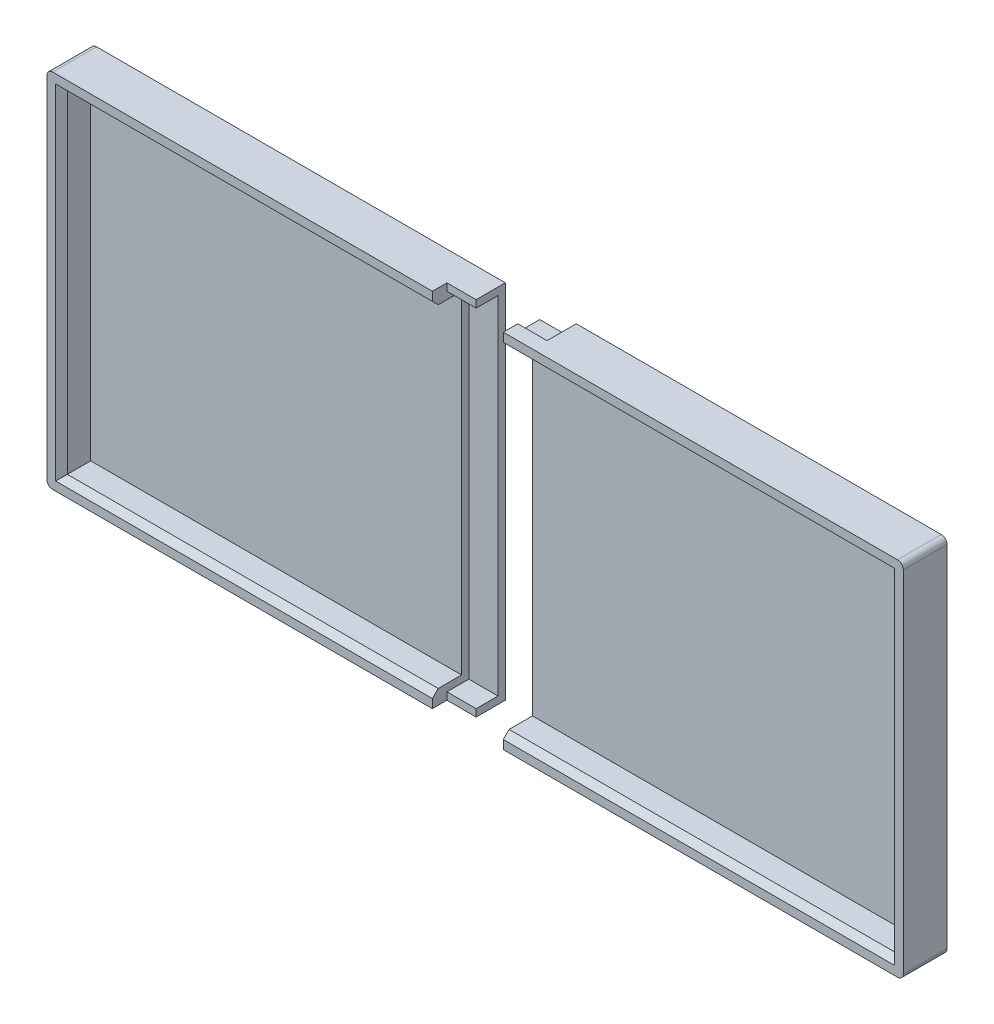
from build123d import *

# Parameters (mm, degrees)
BOSS_EXTRUDE1_DEPTH = 12.7
SKETCH2_W           = 167.64
SKETCH2_H           = 157.226
BOSS_EXTRUDE2_DEPTH = 6.35
FILLET1_R           = 2.54
FILLET2_SIZE        = 2.54
BOSS_EXTRUDE6_DEPTH = 12.7
SKETCH8_W           = 173.99
SKETCH8_H           = 157.226
BOSS_EXTRUDE7_DEPTH = 6.35
CHAMFER1_SIZE       = 2.54
FILLET4_R           = 2.54
BOSS_EXTRUDE8_DEPTH = 12.7
CUT_EXTRUDE1_DEPTH  = 12.7


with BuildPart() as part:
    # Sketch1 → Boss-Extrude1 (new body)
    with BuildSketch(Plane.XY):
        Polygon((-80.645, 72.263), (80.645, 72.263), (80.645, 78.613), (-86.995, 78.613), (-86.995, -78.613), (80.645, -78.613), (80.645, -72.263), (-80.645, -72.263), align=None)
    extrude(amount=BOSS_EXTRUDE1_DEPTH)

    # Sketch2 → Boss-Extrude2 (add)
    with BuildSketch(Plane(origin=(0, 0, 0), x_dir=(-1, 0, 0), z_dir=(0, 0, -1))):
        with Locations((3.175, 0)):
            Rectangle(SKETCH2_W, SKETCH2_H)
    extrude(amount=BOSS_EXTRUDE2_DEPTH)

    # Fillet1
    fillet1_edges = [part.edges().sort_by_distance(p)[0] for p in [
        (-86.995, -78.613, 3.175),
        (-86.995, 78.613, 3.175),
    ]]
    fillet(fillet1_edges, radius=FILLET1_R)

    # Fillet2
    fillet2_edges = [part.edges().sort_by_distance(p)[0] for p in [
        (0, -72.263, 12.7),
        (-80.645, 0, 12.7),
        (0, 72.263, 12.7),
    ]]
    chamfer(fillet2_edges, length=FILLET2_SIZE)

    # Sketch9 → Boss-Extrude8 (add)
    with BuildSketch(Plane(origin=(80.645, 0, 0), x_dir=(0, 0, -1), z_dir=(1, 0, 0))):
        Polygon((6.35, -78.613), (-6.355883999, -78.613), (-6.355883999, -75.438), (3.175, -75.438), (3.175, 75.438), (-6.355883999, 75.438), (-6.355883999, 78.613), (6.35, 78.613), align=None)
    extrude(amount=BOSS_EXTRUDE8_DEPTH)


with BuildPart() as body_2:
    # Sketch7 → Boss-Extrude6 (new body)
    with BuildSketch(Plane.XY):
        Polygon((285.472121408, 78.613), (111.482121408, 78.613), (111.482121408, 72.263), (279.122121408, 72.263), (279.122121408, -72.263), (111.482121408, -72.263), (111.482121408, -78.613), (285.472121408, -78.613), align=None)
    extrude(amount=BOSS_EXTRUDE6_DEPTH)

    # Sketch8 → Boss-Extrude7 (add)
    with BuildSketch(Plane(origin=(0, 0, 0), x_dir=(-1, 0, 0), z_dir=(0, 0, -1))):
        with Locations((-198.477121408, 0)):
            Rectangle(SKETCH8_W, SKETCH8_H)
    extrude(amount=BOSS_EXTRUDE7_DEPTH)

    # Chamfer1
    chamfer1_edges = [body_2.edges().sort_by_distance(p)[0] for p in [
        (279.122121408, 0, 12.7),
        (195.302121408, -72.263, 12.7),
        (195.302121408, 72.263, 12.7),
    ]]
    chamfer(chamfer1_edges, length=CHAMFER1_SIZE)

    # Fillet4
    fillet4_edges = [body_2.edges().sort_by_distance(p)[0] for p in [
        (285.472121408, 78.613, 3.175),
        (285.472121408, -78.613, 3.175),
    ]]
    fillet(fillet4_edges, radius=FILLET4_R)

    # Sketch10 → Cut-Extrude1 (cut)
    with BuildSketch(Plane.ZY.offset(-111.482121408)):
        Polygon((-6.35, 78.613), (6.355883999, 78.613), (6.355883999, 75.438), (-3.175, 75.438), (-3.175, -75.438), (6.355883999, -75.438), (6.355883999, -78.613), (-6.35, -78.613), align=None)
    extrude(amount=-CUT_EXTRUDE1_DEPTH, mode=Mode.SUBTRACT)


solid = Compound([part.part, body_2.part])
